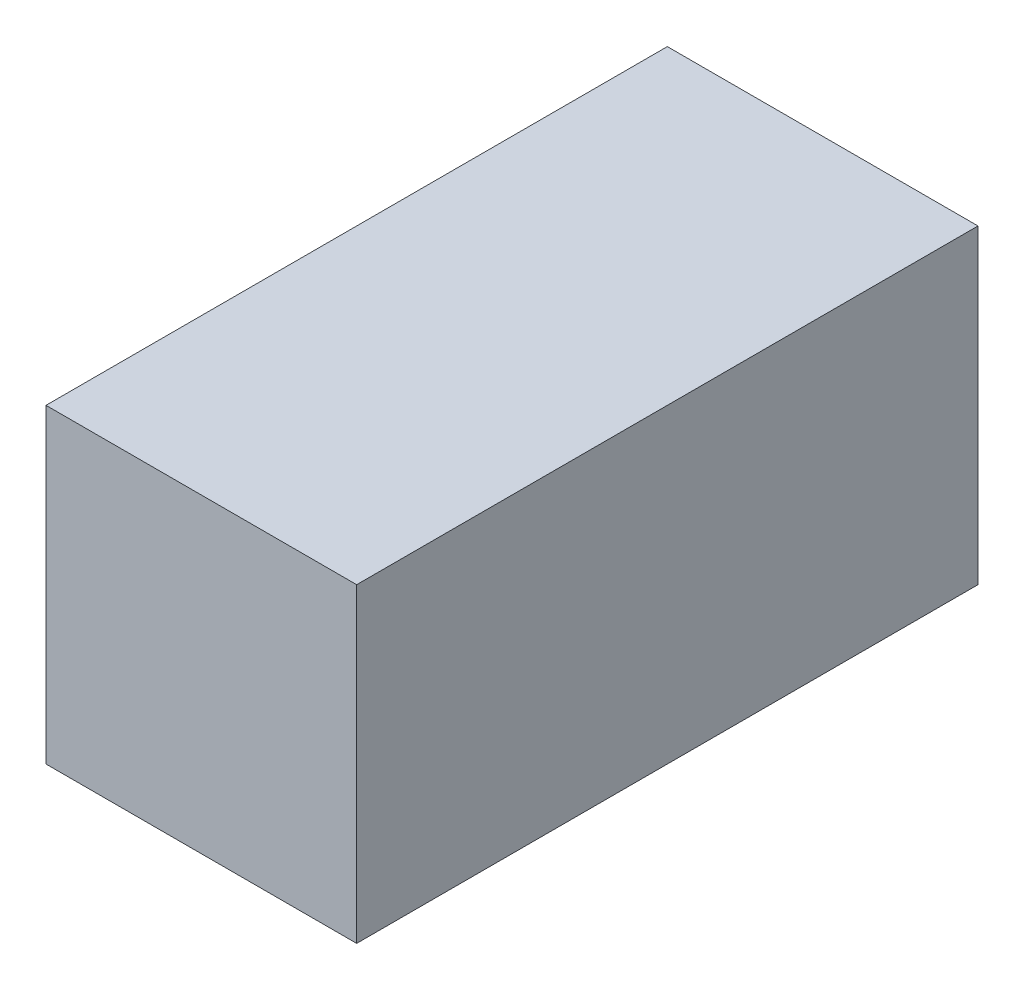
from build123d import *

# Parameters (mm, degrees)
CROQUIS1_W              = 25
CROQUIS1_H              = 25
SALIENTE_EXTRUIR1_DEPTH = 50


with BuildPart() as part:
    # Croquis1 → Saliente-Extruir1 (new body)
    with BuildSketch(Plane.XY):
        with Locations((-6.066037907, 6.085314092)):
            Rectangle(CROQUIS1_W, CROQUIS1_H)
    extrude(amount=-SALIENTE_EXTRUIR1_DEPTH)


solid = part.part
